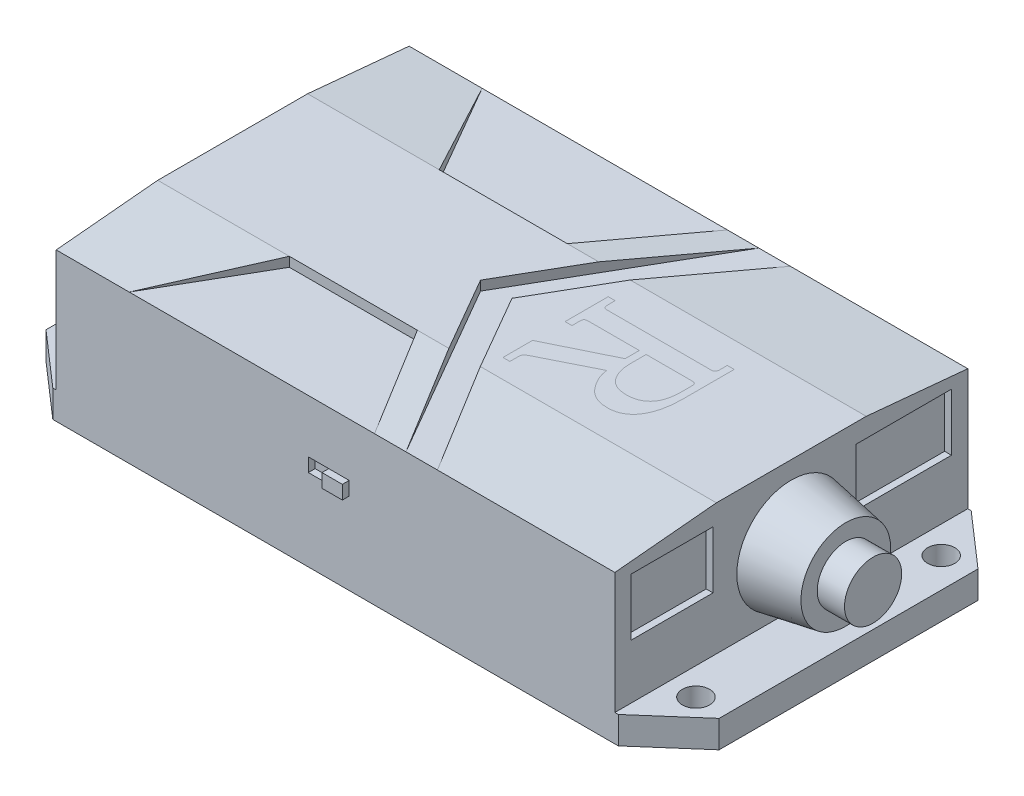
from build123d import *

# Parameters (mm, degrees)
SKETCH_1_R          = 1
EXTRUDE_1_DEPTH     = 2
SKETCH_2_W          = 41
SKETCH_2_H          = 25.9
EXTRUDE_2_DEPTH     = 9.6
CUT_EXTRUDE_1_DEPTH = 49.428323324
CUT_EXTRUDE_2_DEPTH = 0.7
SKETCH_5_R          = 1.25
EXTRUDE_3_DEPTH     = 2
SKETCH_6_R          = 4
EXTRUDE_4_DEPTH     = 4
EXTRUDE_4_TAPER     = 10
SKETCH_7_R          = 2.1
EXTRUDE_5_DEPTH     = 2
SKETCH_8_W          = 12
SKETCH_8_H          = 4.5
CUT_EXTRUDE_3_DEPTH = 0.5
SKETCH_9_W          = 7
SKETCH_9_H          = 4.2
SKETCH_9_W_2        = 6
CUT_EXTRUDE_4_DEPTH = 0.5
SKETCH_12_W         = 3
SKETCH_12_H         = 1
CUT_EXTRUDE_5_DEPTH = 0.5
SKETCH_13_W         = 1.5
SKETCH_13_H         = 1
EXTRUDE_6_DEPTH     = 1


with BuildPart() as part:
    # 草图1 → 凸台-拉伸1 (new body)
    with BuildSketch(Plane(origin=(0, 0, 0), x_dir=(1, 0, 0), z_dir=(0, 1, 0))):
        Polygon((-20.75, 12.95), (20.75, 12.95), (24.7, 9.5), (24.7, -9.5), (20.75, -12.95), (-20.75, -12.95), (-24.7, -9.5), (-24.7, 9.5), align=None)
        with Locations(Location((22.5, 9, 0), (0, 0, 270))):
            Circle(SKETCH_1_R, mode=Mode.SUBTRACT)
        with Locations(Location((22.5, -9, 0), (0, 0, 270))):
            Circle(SKETCH_1_R, mode=Mode.SUBTRACT)
        with Locations(Location((-22.5, -9, 0), (0, 0, 270))):
            Circle(SKETCH_1_R, mode=Mode.SUBTRACT)
        with Locations(Location((-22.5, 9, 0), (0, 0, 270))):
            Circle(SKETCH_1_R, mode=Mode.SUBTRACT)
    extrude(amount=EXTRUDE_1_DEPTH)

    # 草图2 → 凸台-拉伸2 (add)
    with BuildSketch(Plane(origin=(0, 2, 0), x_dir=(1, 0, 0), z_dir=(0, 1, 0))):
        Rectangle(SKETCH_2_W, SKETCH_2_H)
    extrude(amount=EXTRUDE_2_DEPTH)

    # 草图3 → 切除-拉伸1 (cut, through all)
    with BuildSketch(Plane(origin=(20.5, 0, 0), x_dir=(0, 0, -1), z_dir=(1, 0, 0))):
        Polygon((-5.5, 11.6), (-12.95, 10.9), (-12.95, 11.6), align=None)
        Polygon((12.95, 11.6), (5.5, 11.6), (12.95, 10.9), align=None)
    extrude(amount=-CUT_EXTRUDE_1_DEPTH, mode=Mode.SUBTRACT)

    # 草图4 → 切除-拉伸2 (cut)
    with BuildSketch(Plane(origin=(0, 11.6, 0), x_dir=(1, 0, 0), z_dir=(0, 1, 0))):
        Polygon((7.476685986, 12.95), (0, 0), (7.476685986, -12.95), (5.167284909, -12.95), (-2.309401077, 0), (5.167284909, 12.95), align=None)
        Polygon((2.857883832, 12.95), (-1.443375673, 5.5), (-10.840856662, 5.5), (-15.142116168, 12.95), align=None)
        Polygon((-1.443375673, -5.5), (2.857883832, -12.95), (-15.142116168, -12.95), (-10.840856662, -5.5), align=None)
    extrude(amount=-CUT_EXTRUDE_2_DEPTH, mode=Mode.SUBTRACT)

    # 草图5 → 凸台-拉伸3 (add)
    with BuildSketch(Plane.ZY.offset(20.5)):
        with Locations(Location((0, 3.5, 0), (0, 0, 180))):
            Circle(SKETCH_5_R)
        with Locations(Location((4, 3.5, 0), (0, 0, 180))):
            Circle(SKETCH_5_R)
        with Locations(Location((-4, 3.5, 0), (0, 0, 180))):
            Circle(SKETCH_5_R)
    extrude(amount=EXTRUDE_3_DEPTH)

    # 草图6 → 凸台-拉伸4 (add)
    with BuildSketch(Plane(origin=(20.5, 0, 0), x_dir=(0, 0, -1), z_dir=(1, 0, 0))):
        with Locations((0, 6.3)):
            Circle(SKETCH_6_R)
    extrude(amount=EXTRUDE_4_DEPTH, taper=EXTRUDE_4_TAPER)

    # 草图7 → 凸台-拉伸5 (add)
    with BuildSketch(Plane(origin=(24.5, 0, 0), x_dir=(0, 0, -1), z_dir=(1, 0, 0))):
        with Locations((0, 6.3)):
            Circle(SKETCH_7_R)
    extrude(amount=EXTRUDE_5_DEPTH)

    # 草图8 → 切除-拉伸3 (cut)
    with BuildSketch(Plane.ZY.offset(20.5)):
        with Locations((0, 8.25)):
            Rectangle(SKETCH_8_W, SKETCH_8_H)
    extrude(amount=-CUT_EXTRUDE_3_DEPTH, mode=Mode.SUBTRACT)

    # 草图9 → 切除-拉伸4 (cut)
    with BuildSketch(Plane(origin=(20.5, 0, 0), x_dir=(0, 0, -1), z_dir=(1, 0, 0))):
        with Locations((8.25, 8.1)):
            Rectangle(SKETCH_9_W, SKETCH_9_H)
        with Locations((-8.75, 8.1)):
            Rectangle(SKETCH_9_W_2, SKETCH_9_H)
    extrude(amount=-CUT_EXTRUDE_4_DEPTH, mode=Mode.SUBTRACT)

    # 草图12 → 切除-拉伸5 (cut)
    with BuildSketch(Plane.XY.offset(12.95)):
        with Locations((-0.5, 6.5)):
            Rectangle(SKETCH_12_W, SKETCH_12_H)
    extrude(amount=-CUT_EXTRUDE_5_DEPTH, mode=Mode.SUBTRACT)

    # 草图13 → 凸台-拉伸6 (add)
    with BuildSketch(Plane.XY.offset(12.45)):
        with Locations((0.25, 6.5)):
            Rectangle(SKETCH_13_W, SKETCH_13_H)
    extrude(amount=EXTRUDE_6_DEPTH)


solid = part.part
